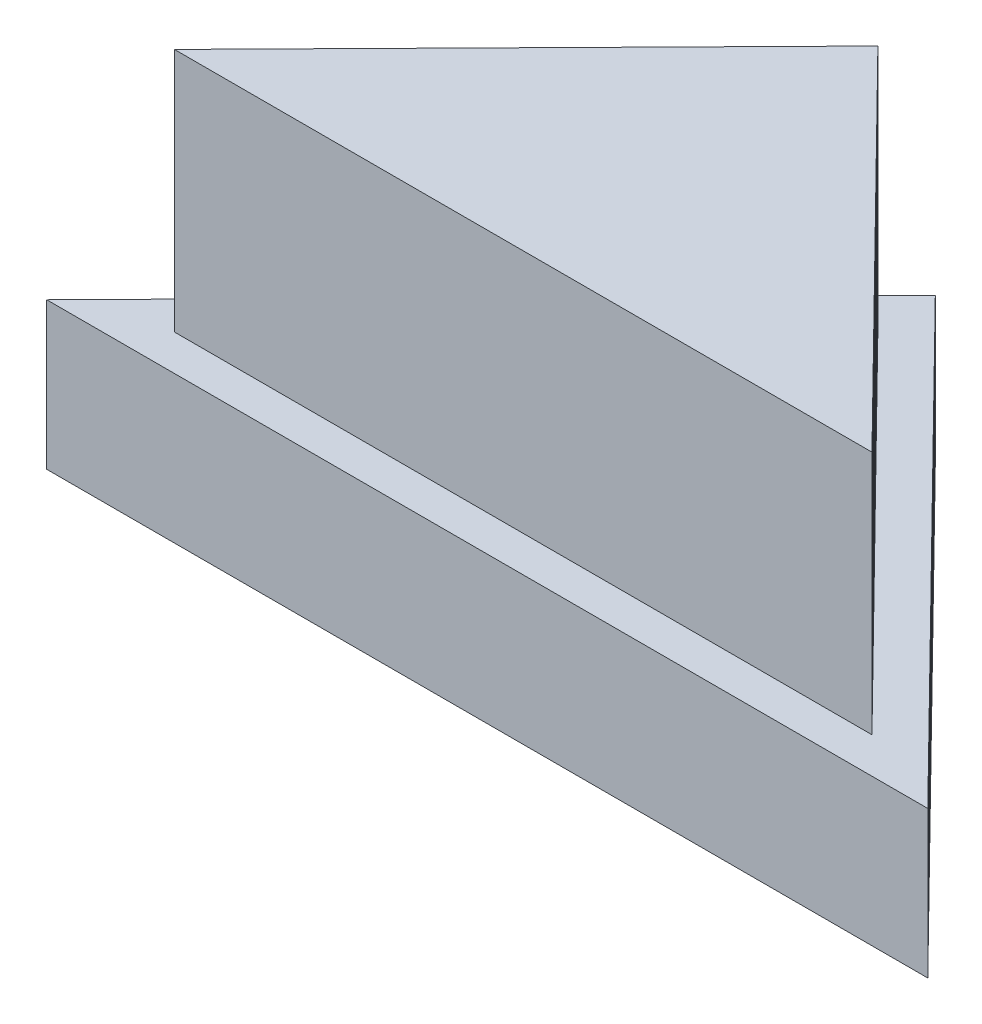
from build123d import *

# Parameters (mm, degrees)
BOSS_EXTRUDE1_DEPTH = 3
BOSS_EXTRUDE2_DEPTH = 5
SKETCH3_R           = 1.8
CUT_EXTRUDE1_DEPTH  = 1


with BuildPart() as part:
    # Sketch1 → Boss-Extrude1 (new body)
    with BuildSketch(Plane(origin=(0, 0, 0), x_dir=(1, 0, 0), z_dir=(0, 1, 0))):
        Polygon((8.983252998, -8.397111121), (-9.016747002, -8.397111121), (-0.016747002, 0.756293591), align=None)
    extrude(amount=BOSS_EXTRUDE1_DEPTH)

    # Sketch2 → Boss-Extrude2 (add)
    with BuildSketch(Plane(origin=(0, 3, 0), x_dir=(1, 0, 0), z_dir=(0, 1, 0))):
        Polygon((7.109021951, -7.663380877), (-0.015978049, -0.416935476), (-7.141084887, -7.663380877), align=None)
    extrude(amount=BOSS_EXTRUDE2_DEPTH)

    # Sketch3 → Cut-Extrude1 (cut)
    with BuildSketch(Plane.XZ):
        with Locations(Location((-0.016747002, 5.345976217, 0), (0, 0, 270))):
            Circle(SKETCH3_R)
    extrude(amount=-CUT_EXTRUDE1_DEPTH, mode=Mode.SUBTRACT)


solid = part.part
